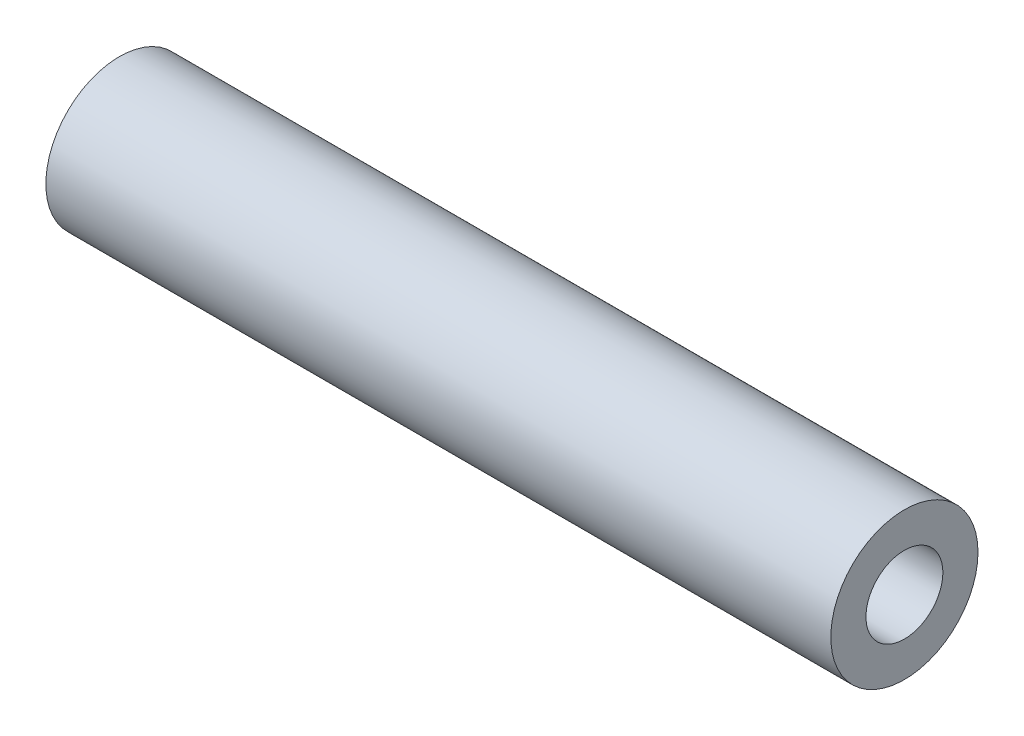
from build123d import *

# Parameters (mm, degrees)
SKETCH1_R           = 4.7625
SKETCH1_R_2         = 2.4892
BOSS_EXTRUDE1_DEPTH = 25.4


with BuildPart() as part:
    # Sketch1 → Boss-Extrude1 (new, symmetric)
    with BuildSketch(Plane(origin=(0, 0, 0), x_dir=(0, 0, -1), z_dir=(1, 0, 0))):
        Circle(SKETCH1_R)
        Circle(SKETCH1_R_2, mode=Mode.SUBTRACT)
    extrude(amount=BOSS_EXTRUDE1_DEPTH, both=True)


solid = part.part
